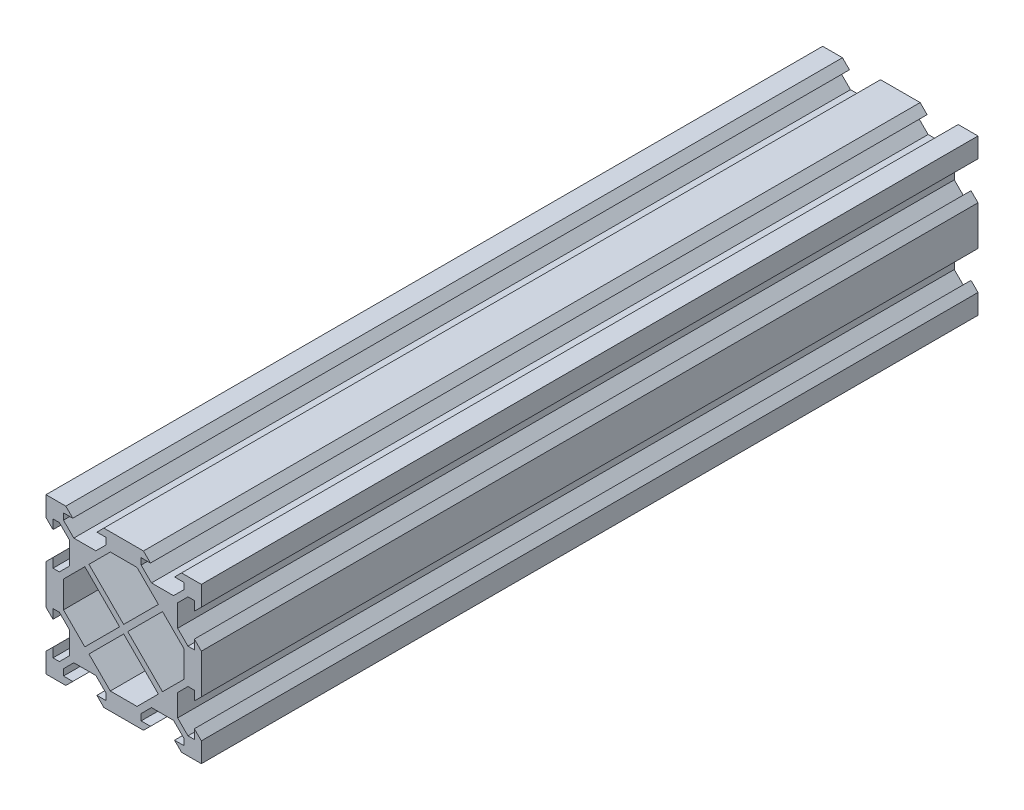
from build123d import *

# Parameters (mm, degrees)
SKETCH2_W              = 20
SKETCH2_H              = 20
BOSS_EXTRUDE1_DEPTH    = 200
CUT_EXTRUDE1_DEPTH     = 201.499376558
CIRPATTERN2_COUNT      = 4
LPATTERN1_COUNT        = 2
LPATTERN1_PITCH        = 20
LPATTERN1_COUNT_DIR2   = 2
LPATTERN1_PITCH_DIR2   = 20
LPATTERN1_COPY_1_DEPTH = 201.499376558
LPATTERN1_COPY_2_DEPTH = 201.499376558
LPATTERN1_COPY_3_DEPTH = 201.499376558
LPATTERN1_COPY_4_DEPTH = 201.499376558
LPATTERN1_COPY_5_DEPTH = 201.499376558
LPATTERN1_COPY_6_DEPTH = 201.499376558
LPATTERN1_COPY_7_DEPTH = 201.499376558
LPATTERN1_COPY_8_DEPTH = 201.499376558
LPATTERN1_COPY_9_DEPTH = 201.499376558
CUT_EXTRUDE2_DEPTH     = 205.450483003


with BuildPart() as part:
    # Sketch2 → Boss-Extrude1 (new body)
    with BuildSketch(Plane.XY):
        Rectangle(SKETCH2_W, SKETCH2_H)
    boss_extrude1 = extrude(amount=-BOSS_EXTRUDE1_DEPTH)

    # Sketch3 → Cut-Extrude1 (cut, symmetric)
    with BuildSketch(Plane.XY):
        Polygon((-3.1, 8.2), (-4.9, 10), (4.9, 10), (3.1, 8.2), (5.5, 8.2), (5.5, 6.56), (2.84, 3.9), (-2.84, 3.9), (-5.5, 6.56), (-5.5, 8.2), align=None)
    cut_extrude1 = extrude(amount=CUT_EXTRUDE1_DEPTH, both=True, mode=Mode.SUBTRACT)

    # CirPattern2: Cut-Extrude1 ×4 about axis
    cirpattern2_axis = Axis((0, 0, 0), (0, 0, 1))
    for i in range(1, CIRPATTERN2_COUNT):
        add(cut_extrude1.rotate(cirpattern2_axis, i * 360 / CIRPATTERN2_COUNT), mode=Mode.SUBTRACT)

    # LPattern1: Boss-Extrude1, Cut-Extrude1 2 × 2
    with Locations(*[(j * LPATTERN1_PITCH_DIR2, i * LPATTERN1_PITCH, 0) for i in range(LPATTERN1_COUNT) for j in range(LPATTERN1_COUNT_DIR2) if (i, j) != (0, 0)]):
        add(boss_extrude1)
        add(cut_extrude1, mode=Mode.SUBTRACT)

    # LPattern1 copy 1 sketch → LPattern1 copy 1 (cut, symmetric)
    with BuildSketch(Plane(origin=(20, 0, 0), x_dir=(0, 1, 0), z_dir=(0, 0, 1))):
        Polygon((-3.1, 8.2), (-4.9, 10), (4.9, 10), (3.1, 8.2), (5.5, 8.2), (5.5, 6.56), (2.84, 3.9), (-2.84, 3.9), (-5.5, 6.56), (-5.5, 8.2), align=None)
    extrude(amount=LPATTERN1_COPY_1_DEPTH, both=True, mode=Mode.SUBTRACT)

    # LPattern1 copy 2 sketch → LPattern1 copy 2 (cut, symmetric)
    with BuildSketch(Plane(origin=(0, 20, 0), x_dir=(0, 1, 0), z_dir=(0, 0, 1))):
        Polygon((-3.1, 8.2), (-4.9, 10), (4.9, 10), (3.1, 8.2), (5.5, 8.2), (5.5, 6.56), (2.84, 3.9), (-2.84, 3.9), (-5.5, 6.56), (-5.5, 8.2), align=None)
    extrude(amount=LPATTERN1_COPY_2_DEPTH, both=True, mode=Mode.SUBTRACT)

    # LPattern1 copy 3 sketch → LPattern1 copy 3 (cut, symmetric)
    with BuildSketch(Plane(origin=(20, 20, 0), x_dir=(0, 1, 0), z_dir=(0, 0, 1))):
        Polygon((-3.1, 8.2), (-4.9, 10), (4.9, 10), (3.1, 8.2), (5.5, 8.2), (5.5, 6.56), (2.84, 3.9), (-2.84, 3.9), (-5.5, 6.56), (-5.5, 8.2), align=None)
    extrude(amount=LPATTERN1_COPY_3_DEPTH, both=True, mode=Mode.SUBTRACT)

    # LPattern1 copy 4 sketch → LPattern1 copy 4 (cut, symmetric)
    with BuildSketch(Plane(origin=(20, 0, 0), x_dir=(-1, 0, 0), z_dir=(0, 0, 1))):
        Polygon((-3.1, 8.2), (-4.9, 10), (4.9, 10), (3.1, 8.2), (5.5, 8.2), (5.5, 6.56), (2.84, 3.9), (-2.84, 3.9), (-5.5, 6.56), (-5.5, 8.2), align=None)
    extrude(amount=LPATTERN1_COPY_4_DEPTH, both=True, mode=Mode.SUBTRACT)

    # LPattern1 copy 5 sketch → LPattern1 copy 5 (cut, symmetric)
    with BuildSketch(Plane(origin=(0, 20, 0), x_dir=(-1, 0, 0), z_dir=(0, 0, 1))):
        Polygon((-3.1, 8.2), (-4.9, 10), (4.9, 10), (3.1, 8.2), (5.5, 8.2), (5.5, 6.56), (2.84, 3.9), (-2.84, 3.9), (-5.5, 6.56), (-5.5, 8.2), align=None)
    extrude(amount=LPATTERN1_COPY_5_DEPTH, both=True, mode=Mode.SUBTRACT)

    # LPattern1 copy 6 sketch → LPattern1 copy 6 (cut, symmetric)
    with BuildSketch(Plane(origin=(20, 20, 0), x_dir=(-1, 0, 0), z_dir=(0, 0, 1))):
        Polygon((-3.1, 8.2), (-4.9, 10), (4.9, 10), (3.1, 8.2), (5.5, 8.2), (5.5, 6.56), (2.84, 3.9), (-2.84, 3.9), (-5.5, 6.56), (-5.5, 8.2), align=None)
    extrude(amount=LPATTERN1_COPY_6_DEPTH, both=True, mode=Mode.SUBTRACT)

    # LPattern1 copy 7 sketch → LPattern1 copy 7 (cut, symmetric)
    with BuildSketch(Plane(origin=(20, 0, 0), x_dir=(0, -1, 0), z_dir=(0, 0, 1))):
        Polygon((-3.1, 8.2), (-4.9, 10), (4.9, 10), (3.1, 8.2), (5.5, 8.2), (5.5, 6.56), (2.84, 3.9), (-2.84, 3.9), (-5.5, 6.56), (-5.5, 8.2), align=None)
    extrude(amount=LPATTERN1_COPY_7_DEPTH, both=True, mode=Mode.SUBTRACT)

    # LPattern1 copy 8 sketch → LPattern1 copy 8 (cut, symmetric)
    with BuildSketch(Plane(origin=(0, 20, 0), x_dir=(0, -1, 0), z_dir=(0, 0, 1))):
        Polygon((-3.1, 8.2), (-4.9, 10), (4.9, 10), (3.1, 8.2), (5.5, 8.2), (5.5, 6.56), (2.84, 3.9), (-2.84, 3.9), (-5.5, 6.56), (-5.5, 8.2), align=None)
    extrude(amount=LPATTERN1_COPY_8_DEPTH, both=True, mode=Mode.SUBTRACT)

    # LPattern1 copy 9 sketch → LPattern1 copy 9 (cut, symmetric)
    with BuildSketch(Plane(origin=(20, 20, 0), x_dir=(0, -1, 0), z_dir=(0, 0, 1))):
        Polygon((-3.1, 8.2), (-4.9, 10), (4.9, 10), (3.1, 8.2), (5.5, 8.2), (5.5, 6.56), (2.84, 3.9), (-2.84, 3.9), (-5.5, 6.56), (-5.5, 8.2), align=None)
    extrude(amount=LPATTERN1_COPY_9_DEPTH, both=True, mode=Mode.SUBTRACT)

    # Sketch9 → Cut-Extrude2 (cut, through all)
    with BuildSketch(Plane.XY):
        Polygon((1.06, 0), (6.56, -5.5), (13.44, -5.5), (18.94, 0), (10, 8.94), align=None)
        Polygon((20, 1.06), (25.5, 6.56), (25.5, 11.8), (25.5, 13.44), (20, 18.94), (11.06, 10), align=None)
        Polygon((0, 1.06), (8.94, 10), (0, 18.94), (-5.5, 13.44), (-5.5, 6.56), align=None)
        Polygon((1.06, 20), (10, 11.06), (18.94, 20), (13.44, 25.5), (6.56, 25.5), align=None)
    extrude(amount=-CUT_EXTRUDE2_DEPTH, mode=Mode.SUBTRACT)


solid = part.part
